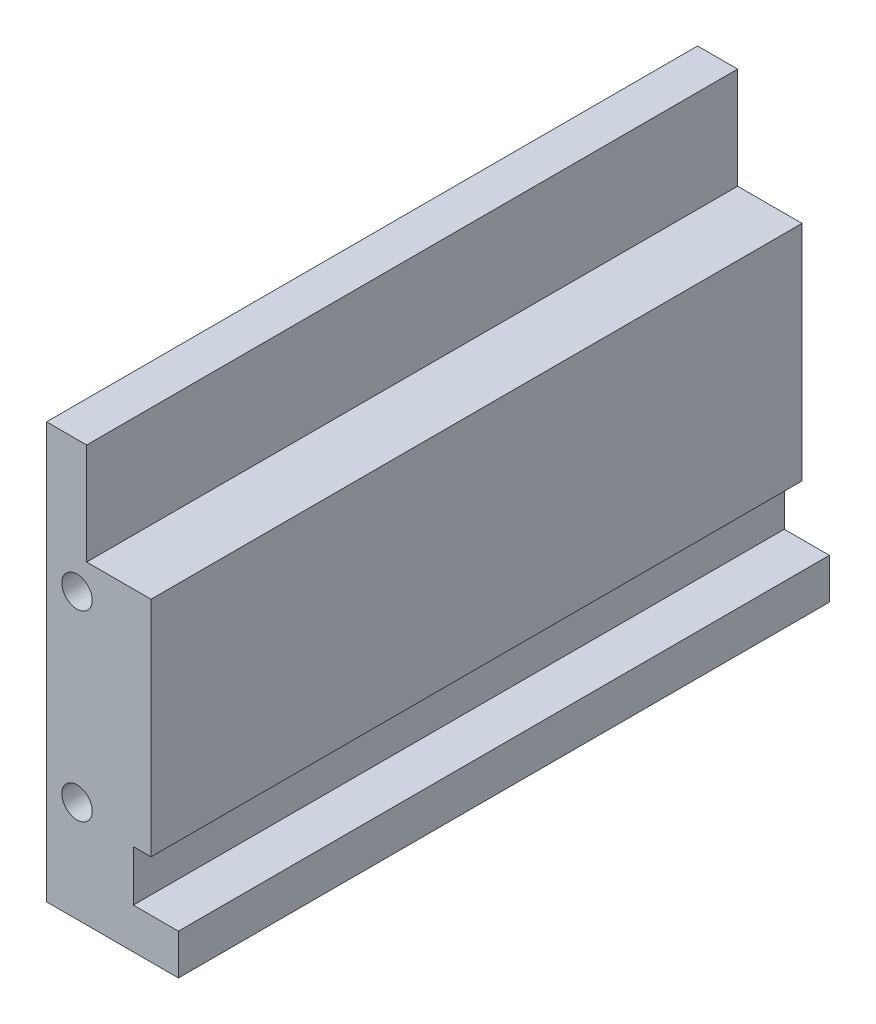
from build123d import *

# Parameters (mm, degrees)
BOSS_EXTRUDE1_DEPTH = 64.2
SKETCH2_R           = 1.5
CUT_EXTRUDE1_DEPTH  = 5


with BuildPart() as part:
    # Sketch1 → Boss-Extrude1 (new body)
    with BuildSketch(Plane.XY):
        Polygon((0, 0), (0, 41), (3.95, 41), (3.95, 31), (10.3, 31), (10.3, 9), (8.55, 9), (8.55, 4), (13, 4), (13, 0), align=None)
    extrude(amount=BOSS_EXTRUDE1_DEPTH)

    # Sketch2 → Cut-Extrude1 (cut)
    with BuildSketch(Plane.XY.offset(64.2)):
        with Locations((3, 28)):
            Circle(SKETCH2_R)
        with Locations((3, 10)):
            Circle(SKETCH2_R)
    cut_extrude1 = extrude(amount=-CUT_EXTRUDE1_DEPTH, mode=Mode.SUBTRACT)

    # Mirror1: Cut-Extrude1 across plane
    add(cut_extrude1.mirror(Plane.XY.offset(32.1)), mode=Mode.SUBTRACT)


solid = part.part
